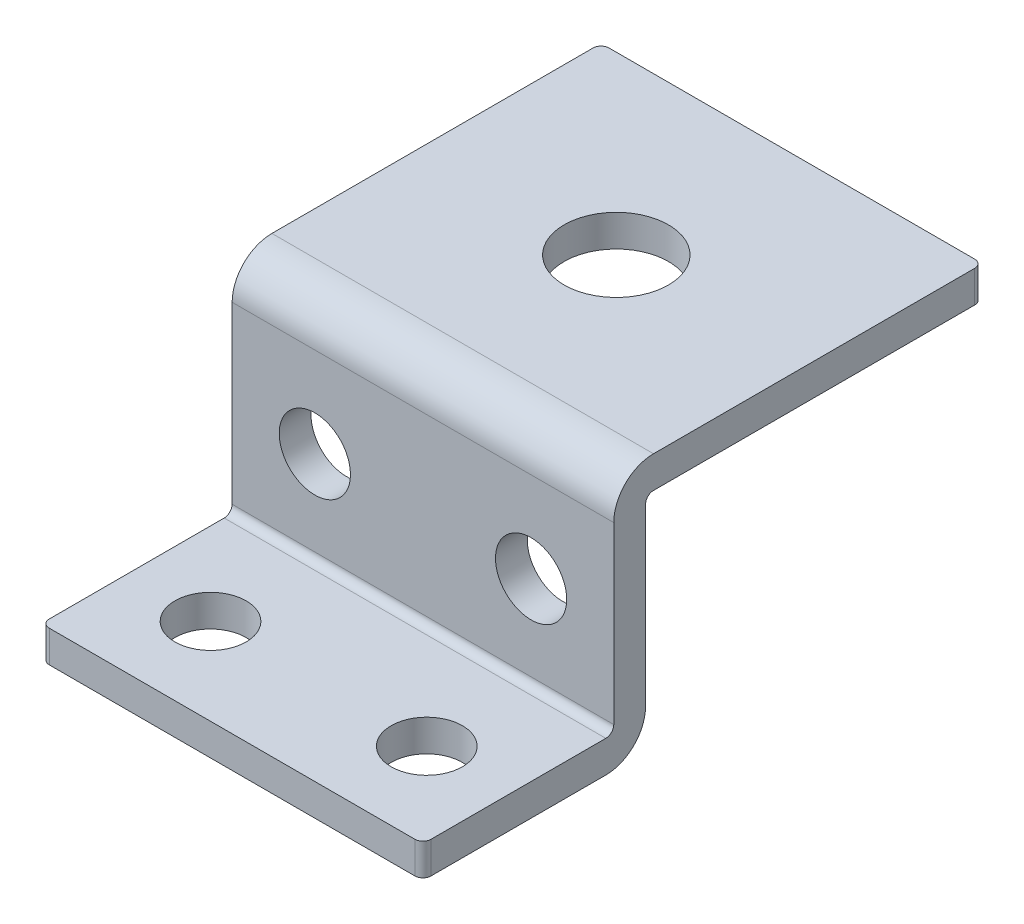
from build123d import *

# Parameters (mm, degrees)
EXTRUDE_THIN2_DEPTH     = 19.05
CUT_EXTRUDE1_DEPTH      = 37.122515139
CUT_EXTRUDE1_DEPTH_BACK = 37.122515139
SKETCH7_R               = 5.207
SKETCH7_R_2             = 3.556
CUT_EXTRUDE2_DEPTH      = 37.122515139
CUT_EXTRUDE2_DEPTH_BACK = 37.122515139
SKETCH8_R               = 3.556
FILLET1_R               = 0.79375


with BuildPart() as part:
    # Sketch5 → Extrude-Thin2 (new, symmetric)
    with BuildSketch(Plane(origin=(0, 0, 0), x_dir=(0, 0, -1), z_dir=(1, 0, 0))):
        with BuildLine():
            Line((-27.94, -9.525), (-9.68375, -9.525))
            ThreePointArc((-9.68375, -9.525), (-9.122483992, -9.292516008), (-8.89, -8.73125))
            Line((-8.89, -8.73125), (-8.89, 8.73125))
            ThreePointArc((-8.89, 8.73125), (-7.727580038, 11.537580038), (-4.92125, 12.7))
            Line((-4.92125, 12.7), (27.94, 12.7))
            Line((27.94, 12.7), (27.94, 9.525))
            Line((27.94, 9.525), (-4.92125, 9.525))
            ThreePointArc((-4.92125, 9.525), (-5.482516008, 9.292516008), (-5.715, 8.73125))
            Line((-5.715, 8.73125), (-5.715, -8.73125))
            ThreePointArc((-5.715, -8.73125), (-6.877419962, -11.537580038), (-9.68375, -12.7))
            Line((-9.68375, -12.7), (-27.94, -12.7))
            Line((-27.94, -12.7), (-27.94, -9.525))
        make_face()
    extrude(amount=EXTRUDE_THIN2_DEPTH, both=True)

    # Sketch7 → Cut-Extrude1 (cut, two sides: drawn at the far end of the back side and taken through both)
    with BuildSketch(Plane(origin=(0, 0, 0), x_dir=(1, 0, 0), z_dir=(0, 1, 0)).offset(-CUT_EXTRUDE1_DEPTH_BACK)):
        with Locations(Location((0, 10.414, 0), (0, 0, 270))):
            Circle(SKETCH7_R)
        with Locations(Location((10.795, -19.304, 0), (0, 0, 270))):
            Circle(SKETCH7_R_2)
        with Locations(Location((-10.795, -19.304, 0), (0, 0, 270))):
            Circle(SKETCH7_R_2)
    extrude(amount=CUT_EXTRUDE1_DEPTH + CUT_EXTRUDE1_DEPTH_BACK, mode=Mode.SUBTRACT)

    # Sketch8 → Cut-Extrude2 (cut, two sides: drawn at the far end of the back side and taken through both)
    with BuildSketch(Plane.XY.offset(-CUT_EXTRUDE2_DEPTH_BACK)):
        with Locations((10.795, -0.254)):
            Circle(SKETCH8_R)
        with Locations((-10.795, -0.254)):
            Circle(SKETCH8_R)
    extrude(amount=CUT_EXTRUDE2_DEPTH + CUT_EXTRUDE2_DEPTH_BACK, mode=Mode.SUBTRACT)

    # Fillet1
    fillet1_edges = [part.edges().sort_by_distance(p)[0] for p in [
        (-19.05, -11.1125, 27.94),
        (-19.05, 11.1125, -27.94),
        (19.05, -11.1125, 27.94),
        (19.05, 11.1125, -27.94),
    ]]
    fillet(fillet1_edges, radius=FILLET1_R)


solid = part.part
